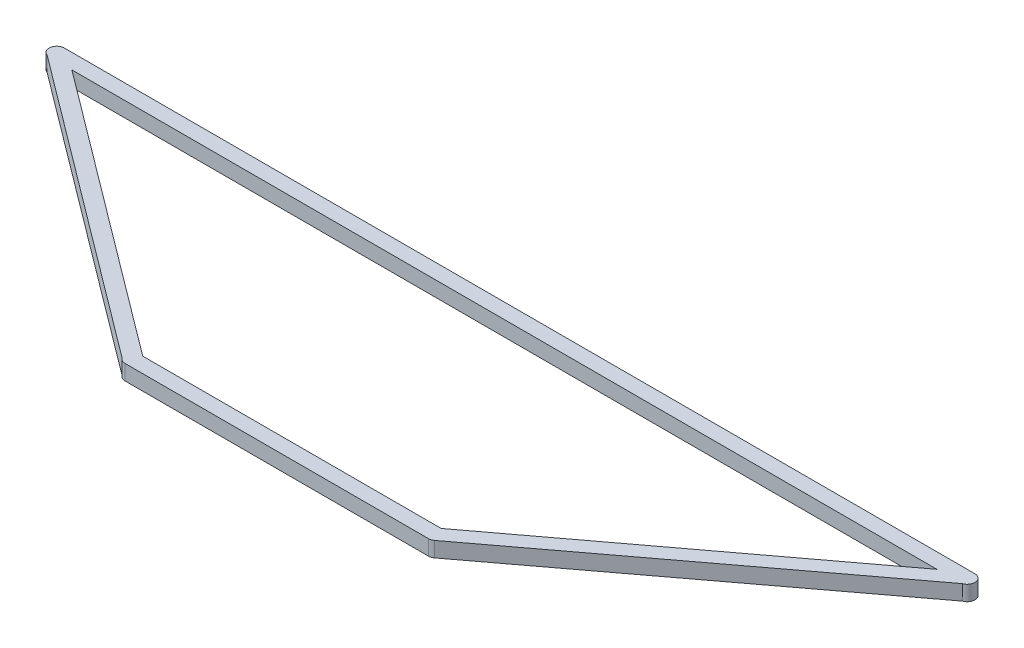
from build123d import *

# Parameters (mm, degrees)
SKETCH1_R           = 10
SKETCH1_W           = 1200
SKETCH1_H           = 20
BOSS_EXTRUDE2_DEPTH = 20


with BuildPart() as part:
    # Sketch1 → Boss-Extrude2 (new body)
    with BuildSketch(Plane(origin=(0, 0, 0), x_dir=(1, 0, 0), z_dir=(0, 1, 0))):
        with Locations((-94.844294643, 267.550423494)):
            Circle(SKETCH1_R)
        with Locations((1105.155705357, 267.550423494)):
            Circle(SKETCH1_R)
        with Locations((305.155705357, -32.449576506)):
            Circle(SKETCH1_R)
        with Locations((705.155705357, -32.449576506)):
            Circle(SKETCH1_R)
        with BuildLine():
            Line((305.155705357, -22.449576506), (705.155705357, -22.449576506))
            Line((705.155705357, -22.449576506), (705.155705357, -42.449576506))
            Line((705.155705357, -42.449576506), (305.155705357, -42.449576506))
            ThreePointArc((305.155705357, -42.449576506), (315.155705357, -32.449576506), (305.155705357, -22.449576506))
        make_face()
        with Locations((505.155705357, 267.550423494)):
            Rectangle(SKETCH1_W, SKETCH1_H)
        Polygon((-88.844294643, 275.550423494), (311.155705357, -24.449576506), (302.050378198, -41.95520343), (-103.100204886, 261.907733883), align=None)
        Polygon((1113.4116156, 261.907733883), (711.164164437, -40.443225203), (699.147246278, -24.455927809), (1099.155705268, 275.550423427), align=None)
    extrude(amount=BOSS_EXTRUDE2_DEPTH)


solid = part.part
